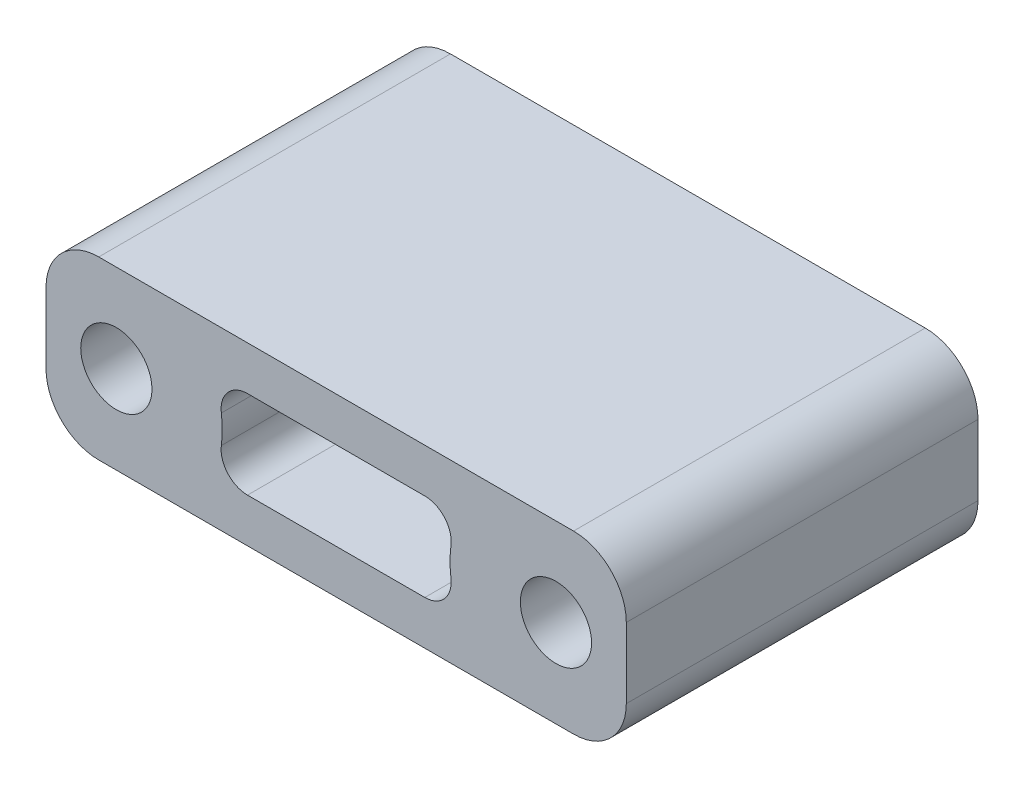
from build123d import *

# Parameters (mm, degrees)
SKETCH_1_W          = 33
SKETCH_1_H          = 10
SKETCH_1_R          = 2.025
EXTRUDE_1_DEPTH     = 10
CUT_EXTRUDE_1_DEPTH = 25
FILLET_1_R          = 1.5
FILLET_2_R          = 3


with BuildPart() as part:
    # 草图1 → 凸台-拉伸1 (new, symmetric)
    with BuildSketch(Plane.XY):
        Rectangle(SKETCH_1_W, SKETCH_1_H)
        with Locations((12.5, 0)):
            Circle(SKETCH_1_R, mode=Mode.SUBTRACT)
        with Locations(Location((-12.5, 0, 0), (0, 0, 180))):
            Circle(SKETCH_1_R, mode=Mode.SUBTRACT)
    extrude(amount=EXTRUDE_1_DEPTH, both=True)

    # 草图2 → 切除-拉伸1 (cut, symmetric)
    with BuildSketch(Plane.XY.offset(10)):
        with BuildLine():
            Line((-7.018154964, 2.5), (7.018154964, 2.5))
            ThreePointArc((7.018154964, 2.5), (6.475, 0), (7.018154964, -2.5))
            Line((7.018154964, -2.5), (-7.018154964, -2.5))
            ThreePointArc((-7.018154964, -2.5), (-6.475, 0), (-7.018154964, 2.5))
        make_face()
    extrude(amount=CUT_EXTRUDE_1_DEPTH, both=True, mode=Mode.SUBTRACT)

    # 圆角1
    fillet_1_edges = [part.edges().sort_by_distance(p)[0] for p in [
        (-7.018154964, -2.5, 0),
        (-7.018154964, 2.5, 0),
        (7.018154964, 2.5, 0),
        (7.018154964, -2.5, 0),
    ]]
    fillet(fillet_1_edges, radius=FILLET_1_R)

    # 圆角2
    fillet_2_edges = [part.edges().sort_by_distance(p)[0] for p in [
        (16.5, -5, 0),
        (-16.5, -5, 0),
        (-16.5, 5, 0),
        (16.5, 5, 0),
    ]]
    fillet(fillet_2_edges, radius=FILLET_2_R)


solid = part.part
